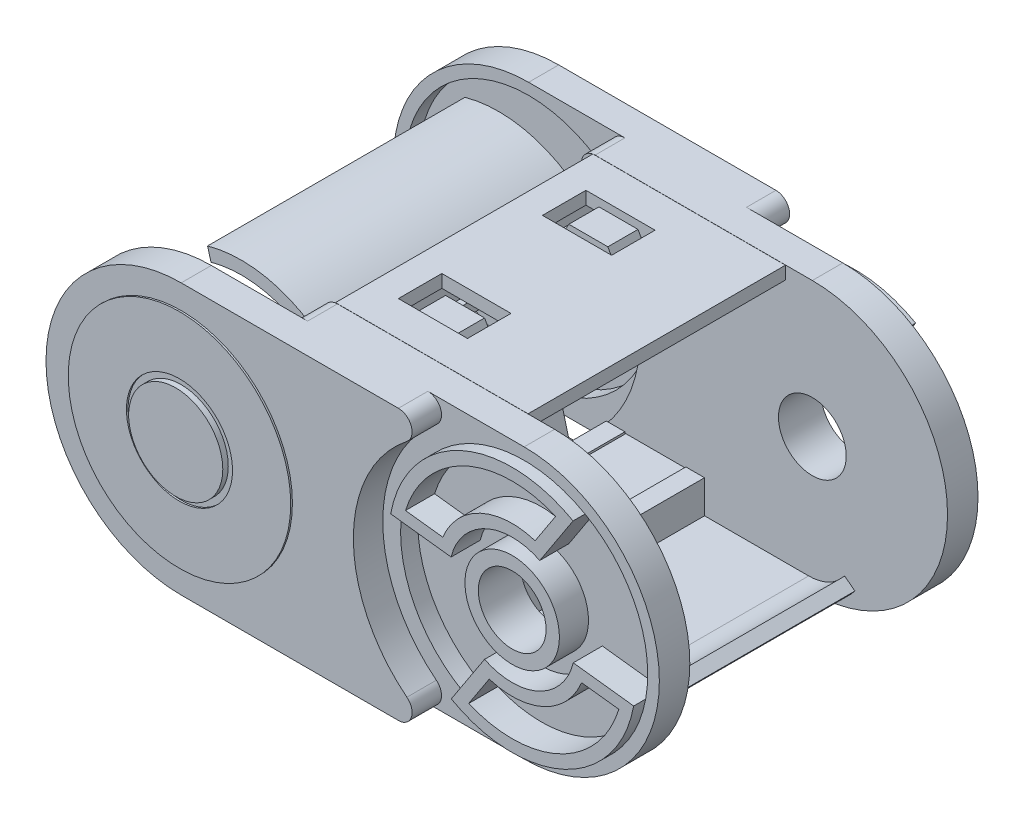
from build123d import *

# Parameters (mm, degrees)
BOSS_EXTRUDE1_START      = 27.575
BOSS_EXTRUDE1_DEPTH      = 8.75
SKETCH3_R                = 20.65
CUT_EXTRUDE2_DEPTH       = 4.3
SKETCH3_3_R              = 5.15
CUT_EXTRUDE10_DEPTH      = 70.017588338
SKETCH3_4_R              = 16.25
SKETCH3_4_R_2            = 7.75
BOSS_EXTRUDE11_DEPTH     = 0.25
SKETCH8_R                = 20.65
CUT_EXTRUDE6_DEPTH       = 4.35
CUT_EXTRUDE7_START       = 4.35
SKETCH9_R                = 18.1
CUT_EXTRUDE7_DEPTH       = 6.5
SKETCH10_R               = 7
BOSS_EXTRUDE3_DEPTH      = 3.9
FILLET1_R                = 0.5
CUT_EXTRUDE8_START       = -4.6
SKETCH11_R               = 7
CUT_EXTRUDE8_DEPTH       = 4.6
FILLET2_R                = 2
SKETCH20_R               = 4.95
CUT_EXTRUDE11_DEPTH      = 69.611715472
SKETCH20_3_R             = 18.05
CUT_EXTRUDE12_DEPTH      = 2.5
BOSS_EXTRUDE12_START     = 4.25
SKETCH21_R               = 6.9
SKETCH21_R_2             = 4.95
BOSS_EXTRUDE12_DEPTH     = 4.25
BOSS_EXTRUDE4_DEPTH      = 10.92
BOSS_EXTRUDE5_START      = -1.1
BOSS_EXTRUDE5_DEPTH      = 4.4
BOSS_EXTRUDE6_DEPTH      = 18.8
SKETCH15_W               = 10.1
SKETCH15_H               = 6.35
CUT_EXTRUDE9_DEPTH       = 5
BOSS_EXTRUDE7_REACH      = 80.402
SKETCH16_W               = 14.35
SKETCH16_H               = 2
SKETCH18_R               = 6.875
BOSS_EXTRUDE9_DEPTH      = 0.8
SKETCH19_R               = 5.1
BOSS_EXTRUDE10_DEPTH     = 8
SKETCH22_W               = 12.15
SKETCH22_H               = 37.65
CUT_EXTRUDE13_DEPTH      = 82.622258759
CUT_EXTRUDE14_DEPTH      = 75.108067206
CUT_EXTRUDE14_DEPTH_BACK = 75.108067206
SKETCH24_W               = 38.20570809
SKETCH24_H               = 12.218638483
BOSS_EXTRUDE13_START     = -18.8
BOSS_EXTRUDE13_DEPTH     = 37.6


with BuildPart() as part:
    # Sketch1 → Boss-Extrude1 (new body)
    with BuildSketch(Plane.XY.offset(BOSS_EXTRUDE1_START)):
        with BuildLine():
            Line((0, 19.75), (45.8, 19.75))
            ThreePointArc((45.8, 19.75), (65.55, 0), (45.8, -19.75))
            Line((45.8, -19.75), (0, -19.75))
            ThreePointArc((0, -19.75), (-19.75, 0), (0, 19.75))
        make_face()
    extrude(amount=-BOSS_EXTRUDE1_DEPTH)

    # Sketch3 → Cut-Extrude2 (cut)
    with BuildSketch(Plane.XY.offset(27.575)):
        with Locations((45.8, 0)):
            Circle(SKETCH3_R)
    extrude(amount=-CUT_EXTRUDE2_DEPTH, mode=Mode.SUBTRACT)

    # Sketch3<3> → Cut-Extrude10 (cut, through all)
    with BuildSketch(Plane.XY.offset(27.575)):
        Circle(SKETCH3_3_R)
    extrude(amount=-CUT_EXTRUDE10_DEPTH, mode=Mode.SUBTRACT)

    # Sketch3<4> → Boss-Extrude11 (add)
    with BuildSketch(Plane.XY.offset(27.575)):
        Circle(SKETCH3_4_R)
        Circle(SKETCH3_4_R_2, mode=Mode.SUBTRACT)
    extrude(amount=BOSS_EXTRUDE11_DEPTH)

    # Sketch8 → Cut-Extrude6 (cut)
    with BuildSketch(Plane(origin=(0, 0, 18.825), x_dir=(-1, 0, 0), z_dir=(0, 0, -1))):
        Circle(SKETCH8_R)
    extrude(amount=-CUT_EXTRUDE6_DEPTH, mode=Mode.SUBTRACT)

    # Sketch9 → Cut-Extrude7 (cut)
    with BuildSketch(Plane(origin=(0, 0, 23.175), x_dir=(-1, 0, 0), z_dir=(0, 0, -1)).offset(CUT_EXTRUDE7_START)):
        Circle(SKETCH9_R)
    extrude(amount=-CUT_EXTRUDE7_DEPTH, mode=Mode.SUBTRACT)

    # Sketch10 → Boss-Extrude3 (add)
    with BuildSketch(Plane(origin=(0, 0, 25.325), x_dir=(-1, 0, 0), z_dir=(0, 0, -1))):
        with BuildLine():
            Line((8.562499635, 2.5), (16.75, 3.2))
            Line((16.75, 3.2), (16.75, -3.2))
            Line((16.75, -3.2), (8.562499635, -2.5))
            ThreePointArc((8.562499635, -2.5), (0, -8.92), (-8.562499635, -2.5))
            Line((-8.562499635, -2.5), (-16.75, -3.2))
            Line((-16.75, -3.2), (-16.75, 3.2))
            Line((-16.75, 3.2), (-8.562499635, 2.5))
            ThreePointArc((-8.562499635, 2.5), (0, 8.92), (8.562499635, 2.5))
        make_face()
        Circle(SKETCH10_R, mode=Mode.SUBTRACT)
        with BuildLine():
            Line((8.872361267, 0.920654955), (15.15, 1.457369083))
            Line((15.15, 1.457369083), (15.15, -1.457369083))
            Line((15.15, -1.457369083), (8.872361267, -0.920654955))
            ThreePointArc((8.872361267, -0.920654955), (8.92, 0), (8.872361267, 0.920654955))
        make_face(mode=Mode.SUBTRACT)
        with BuildLine():
            Line((-8.872361267, 0.920654955), (-15.15, 1.457369083))
            Line((-15.15, 1.457369083), (-15.15, -1.457369083))
            Line((-15.15, -1.457369083), (-8.872361267, -0.920654955))
            ThreePointArc((-8.872361267, -0.920654955), (-8.92, 0), (-8.872361267, 0.920654955))
        make_face(mode=Mode.SUBTRACT)
    extrude(amount=BOSS_EXTRUDE3_DEPTH)

    # Fillet1
    fillet1_edges = [part.edges().sort_by_distance(p)[0] for p in [
        (16.75, 3.2, 23.375),
        (16.75, -3.2, 23.375),
        (-16.75, -3.2, 23.375),
        (-16.75, 3.2, 23.375),
    ]]
    fillet(fillet1_edges, radius=FILLET1_R)

    # Sketch11 → Cut-Extrude8 (cut)
    with BuildSketch(Plane(origin=(0, 0, 21.425), x_dir=(-1, 0, 0), z_dir=(0, 0, -1)).offset(CUT_EXTRUDE8_START)):
        Circle(SKETCH11_R)
    extrude(amount=CUT_EXTRUDE8_DEPTH, mode=Mode.SUBTRACT)

    # Fillet2
    fillet2_edges = [part.edges().sort_by_distance(p)[0] for p in [
        (39.770074627, 19.75, 25.425),
        (39.770074627, -19.75, 25.425),
        (6.029925373, 19.75, 21),
        (6.029925373, -19.75, 21),
    ]]
    fillet(fillet2_edges, radius=FILLET2_R)

    # Sketch20 → Cut-Extrude11 (cut, through all)
    with BuildSketch(Plane.XY.offset(23.275)):
        with Locations((45.8, 0)):
            Circle(SKETCH20_R)
    extrude(amount=-CUT_EXTRUDE11_DEPTH, mode=Mode.SUBTRACT)

    # Sketch20<3> → Cut-Extrude12 (cut)
    with BuildSketch(Plane.XY.offset(23.275)):
        with Locations((45.8, 0)):
            Circle(SKETCH20_3_R)
    extrude(amount=-CUT_EXTRUDE12_DEPTH, mode=Mode.SUBTRACT)

    # Sketch21 → Boss-Extrude12 (add)
    # profile 1 of 3: a face of its own
    with BuildSketch(Plane.XY.offset(20.775).offset(BOSS_EXTRUDE12_START)):
        with Locations((45.8, 0)):
            Circle(SKETCH21_R)
        with Locations((45.8, 0)):
            Circle(SKETCH21_R_2, mode=Mode.SUBTRACT)
    # profile 2 of 3: a face of its own
    with BuildSketch(Plane.XY.offset(20.775).offset(BOSS_EXTRUDE12_START)):
        with BuildLine():
            Line((54.696062952, 15.705494706), (49.833381824, 8.268726084))
            ThreePointArc((49.833381824, 8.268726084), (41.911911992, 8.338031641), (36.87318047, 2.225284942))
            Line((36.87318047, 2.225284942), (28.050614014, 3.28051781))
            ThreePointArc((28.050614014, 3.28051781), (38.171740376, 16.358855556), (54.696062952, 15.705494706))
        make_face()
        with BuildLine():
            Line((52.151463457, 15.011625893), (49.15197162, 10.42433625))
            ThreePointArc((49.15197162, 10.42433625), (41.172330034, 9.924070268), (35.659889317, 4.132874948))
            Line((35.659889317, 4.132874948), (30.217785389, 4.783783838))
            ThreePointArc((30.217785389, 4.783783838), (38.911322334, 14.772816929), (52.151463457, 15.011625893))
        make_face(mode=Mode.SUBTRACT)
    # profile 3 of 3: a face of its own
    with BuildSketch(Plane.XY.offset(20.775).offset(BOSS_EXTRUDE12_START)):
        with BuildLine():
            Line((36.903937048, -15.705494706), (41.766618176, -8.268726084))
            ThreePointArc((41.766618176, -8.268726084), (49.688088008, -8.338031641), (54.72681953, -2.225284942))
            Line((54.72681953, -2.225284942), (63.549385986, -3.28051781))
            ThreePointArc((63.549385986, -3.28051781), (53.428259624, -16.358855556), (36.903937048, -15.705494706))
        make_face()
        with BuildLine():
            Line((39.448536543, -15.011625893), (42.44802838, -10.42433625))
            ThreePointArc((42.44802838, -10.42433625), (50.427669966, -9.924070268), (55.940110683, -4.132874948))
            Line((55.940110683, -4.132874948), (61.382214611, -4.783783838))
            ThreePointArc((61.382214611, -4.783783838), (52.688677666, -14.772816929), (39.448536543, -15.011625893))
        make_face(mode=Mode.SUBTRACT)
    extrude(amount=-BOSS_EXTRUDE12_DEPTH)

    # Sketch12 → Boss-Extrude4 (add)
    with BuildSketch(Plane(origin=(0, 0, 18.825), x_dir=(-1, 0, 0), z_dir=(0, 0, -1))):
        Polygon((-27.45, 17.15), (-18.35, 17.15), (-17.525, 15.65), (-17.525, 14.85), (-18.55, 14.85), (-18.55, 13.25), (-27.25, 13.25), (-27.25, 14.85), (-28.275, 14.85), (-28.275, 15.65), align=None)
        Polygon((-17.525, -15.65), (-17.525, -14.85), (-18.55, -14.85), (-18.55, -13.25), (-27.25, -13.25), (-27.25, -14.85), (-28.275, -14.85), (-28.275, -15.65), (-27.45, -17.15), (-18.35, -17.15), align=None)
    extrude(amount=BOSS_EXTRUDE4_DEPTH)

    # Sketch13 → Boss-Extrude5 (add)
    with BuildSketch(Plane(origin=(0, 0, 7.905), x_dir=(-1, 0, 0), z_dir=(0, 0, -1)).offset(BOSS_EXTRUDE5_START)):
        Polygon((-26.725, 17.15), (-25.75, 18.9), (-20.05, 18.9), (-19.075, 17.15), align=None)
        Polygon((-20.05, -18.9), (-19.075, -17.15), (-26.725, -17.15), (-25.75, -18.9), align=None)
    extrude(amount=-BOSS_EXTRUDE5_DEPTH)


with BuildPart() as body_2:
    # Sketch14 → Boss-Extrude6 (new, symmetric)
    with BuildSketch(Plane.XY):
        with BuildLine():
            Line((45.287324477, 19.75), (8.74, 19.75))
            Line((8.74, 19.75), (7.225327065, 13.882260219))
            ThreePointArc((7.225327065, 13.882260219), (-1.887976259, 15.53570229), (-10.34, 11.747633804))
            Line((-10.34, 11.747633804), (-9.097878594, 10.336416453))
            ThreePointArc((-9.097878594, 10.336416453), (-0.452033649, 13.76257845), (8.4, 10.911136513))
            Line((8.4, 10.911136513), (10.196330883, 17.87))
            Line((10.196330883, 17.87), (15.725, 17.87))
            Line((15.725, 17.87), (15.725, 13.05))
            Line((15.725, 13.05), (18.45, 13.05))
            Line((18.45, 13.05), (18.45, 14.75))
            Line((18.45, 14.75), (17.425, 14.75))
            Line((17.425, 14.75), (17.425, 17.87))
            Line((17.425, 17.87), (28.375, 17.87))
            Line((28.375, 17.87), (28.375, 14.75))
            Line((28.375, 14.75), (27.35, 14.75))
            Line((27.35, 14.75), (27.35, 13.05))
            Line((27.35, 13.05), (30.075, 13.05))
            Line((30.075, 13.05), (30.075, 17.87))
            Line((30.075, 17.87), (45.287324477, 17.87))
            ThreePointArc((45.287324477, 17.87), (48.226296513, 17.181849911), (50.554255296, 15.260466275))
            Line((50.554255296, 15.260466275), (52.05, 16.399390233))
            ThreePointArc((52.05, 16.399390233), (49.060929055, 18.866423602), (45.287324477, 19.75))
        make_face()
    extrude(amount=BOSS_EXTRUDE6_DEPTH, both=True)

    # Sketch15 → Cut-Extrude9 (cut)
    with BuildSketch(Plane(origin=(0, 19.75, 0), x_dir=(1, 0, 0), z_dir=(0, 1, 0))):
        with Locations((22.9, -10.525)):
            Rectangle(SKETCH15_W, SKETCH15_H)
        with Locations((22.9, 10.525)):
            Rectangle(SKETCH15_W, SKETCH15_H)
    extrude(amount=-CUT_EXTRUDE9_DEPTH, mode=Mode.SUBTRACT)

    # Boss-Extrude7: up to this face of the body (flat: up to its plane)
    boss_extrude7_end = Plane(body_2.part.faces().sort_by_distance((37.681162238, 17.87, 0))[0])
    # Sketch16 → Boss-Extrude7 (add, up to the picked face)
    with BuildSketch(Plane.XZ.offset(-13.05), mode=Mode.PRIVATE) as boss_extrude7_sk1:
        with Locations((22.9, 0)):
            Rectangle(SKETCH16_W, SKETCH16_H)
    boss_extrude7_tool1 = split(extrude(boss_extrude7_sk1.sketch, amount=-BOSS_EXTRUDE7_REACH, mode=Mode.PRIVATE), bisect_by=boss_extrude7_end, keep=Keep.BOTH, mode=Mode.PRIVATE)
    add(boss_extrude7_tool1.solids().sort_by(Axis((22.9, 13.05, 0), (0, 1, 0)))[0])


with BuildPart() as body_3:
    # Sketch18 → Boss-Extrude9 (new body)
    with BuildSketch(Plane.XY.offset(27.575)):
        Circle(SKETCH18_R)
    extrude(amount=BOSS_EXTRUDE9_DEPTH)

    # Sketch19 → Boss-Extrude10 (add)
    with BuildSketch(Plane(origin=(0, 0, 27.575), x_dir=(-1, 0, 0), z_dir=(0, 0, -1))):
        Circle(SKETCH19_R)
    extrude(amount=BOSS_EXTRUDE10_DEPTH)


with BuildPart() as body_4:
    # Mirror1: mirrored copy
    add(part.part.mirror(Plane.XY))


with BuildPart() as body_5:
    # Mirror1 2: mirrored copy
    add(body_3.part.mirror(Plane.XY))


with BuildPart() as body_6:
    # Mirror2: mirrored copy
    add(body_2.part.mirror(Plane.ZX))


with BuildPart() as body_2_1:
    add(body_2.part)

    # Sketch22 → Cut-Extrude13 (cut, through all)
    with BuildSketch(Plane.XZ.offset(19.75)):
        with Locations((47.975, 0)):
            Rectangle(SKETCH22_W, SKETCH22_H)
    extrude(amount=-CUT_EXTRUDE13_DEPTH, mode=Mode.SUBTRACT)

    # Sketch24 → Cut-Extrude14 (cut, two sides: drawn at the far end of the back side and taken through both)
    with BuildSketch(Plane.XY.offset(-CUT_EXTRUDE14_DEPTH_BACK)):
        with Locations((-3.877854045, 13.640680759)):
            Rectangle(SKETCH24_W, SKETCH24_H)
    extrude(amount=CUT_EXTRUDE14_DEPTH + CUT_EXTRUDE14_DEPTH_BACK, mode=Mode.SUBTRACT)

    # Sketch23 → Boss-Extrude13 (add)
    with BuildSketch(Plane.XY.offset(BOSS_EXTRUDE13_START)):
        with BuildLine():
            Line((15.225, 17.87), (14.199854415, 13.89865583))
            ThreePointArc((14.199854415, 13.89865583), (12.633793675, 12.230961839), (10.385472043, 12.653808535))
            ThreePointArc((10.385472043, 12.653808535), (3.364510308, 16.02051717), (-4.417657534, 15.762652122))
            Line((-4.417657534, 15.762652122), (-4.925, 17.572901724))
            ThreePointArc((-4.925, 17.572901724), (3.750904895, 17.860381084), (11.578183554, 14.107025398))
            ThreePointArc((11.578183554, 14.107025398), (12.050520031, 14.018192059), (12.379524389, 14.368547939))
            Line((12.379524389, 14.368547939), (13.768669117, 19.75))
            Line((13.768669117, 19.75), (15.225, 19.75))
            Line((15.225, 19.75), (15.225, 17.87))
        make_face()
    extrude(amount=BOSS_EXTRUDE13_DEPTH)


solid = Compound([part.part, body_3.part, body_4.part, body_5.part, body_6.part, body_2_1.part])
